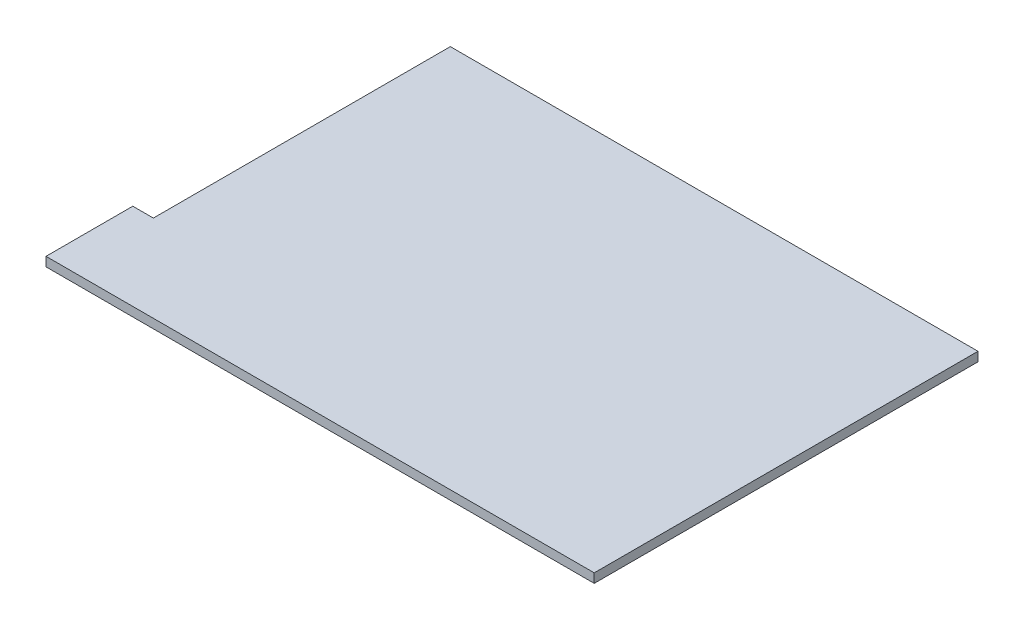
from build123d import *

# Parameters (mm, degrees)
SKETCH1_W           = 762
SKETCH1_H           = 533.4
BOSS_EXTRUDE1_DEPTH = 12.7
SKETCH2_W           = 28.575
SKETCH2_H           = 412.75
CUT_EXTRUDE1_DEPTH  = 931.226235923


with BuildPart() as part:
    # Sketch1 → Boss-Extrude1 (new body)
    with BuildSketch(Plane(origin=(0, 0, 0), x_dir=(1, 0, 0), z_dir=(0, 1, 0))):
        with Locations((381, 266.7)):
            Rectangle(SKETCH1_W, SKETCH1_H)
    extrude(amount=BOSS_EXTRUDE1_DEPTH)

    # Sketch2 → Cut-Extrude1 (cut, through all)
    with BuildSketch(Plane.XZ):
        with Locations((14.2875, -327.025)):
            Rectangle(SKETCH2_W, SKETCH2_H)
    extrude(amount=-CUT_EXTRUDE1_DEPTH, mode=Mode.SUBTRACT)


solid = part.part
